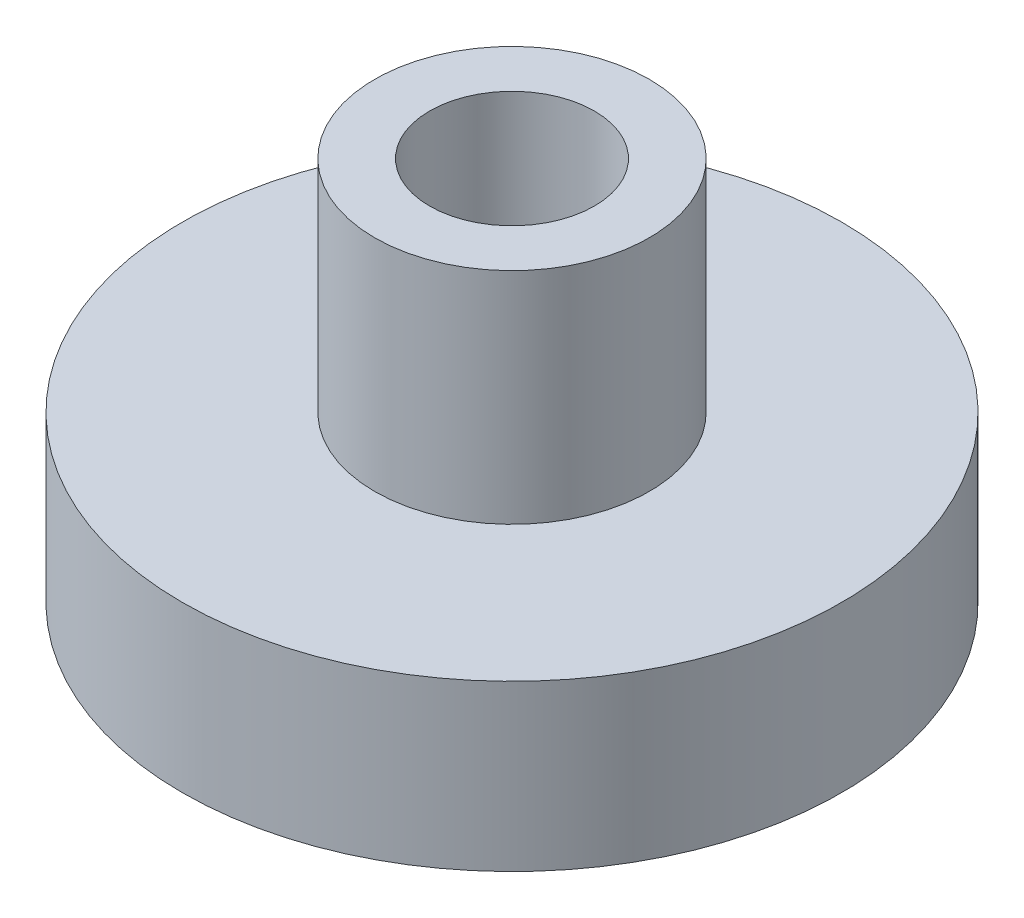
from build123d import *
from build123d.topology import SkipClean

# Parameters (mm, degrees)
SKETCH_1_R      = 2.5
SKETCH_1_R_2    = 1.5
EXTRUDE_1_DEPTH = 4
EXTRUDE_START   = 3
SKETCH_2_R      = 6
SKETCH_2_R_2    = 1.5
EXTRUDE_2_DEPTH = 3


with BuildPart() as part:
    # 草图1 → 凸台-拉伸1 (new body)
    with BuildSketch(Plane(origin=(0, 0, 0), x_dir=(1, 0, 0), z_dir=(0, 1, 0))):
        with Locations(Location((0, 0, 0), (0, 0, 270))):
            Circle(SKETCH_1_R)
        with Locations(Location((0, 0, 0), (0, 0, 270))):
            Circle(SKETCH_1_R_2, mode=Mode.SUBTRACT)
    extrude(amount=EXTRUDE_1_DEPTH)

    # 草图2 → 凸台-拉伸2 (add)
    with SkipClean():  # the faces are left unmerged after this step: merging them gives an invalid solid
        with BuildSketch(Plane.XZ.offset(EXTRUDE_START)):
            with Locations(Location((0, 0, 0), (0, 0, 270))):
                Circle(SKETCH_2_R)
            with Locations(Location((0, 0, 0), (0, 0, 270))):
                Circle(SKETCH_2_R_2, mode=Mode.SUBTRACT)
        extrude(amount=-EXTRUDE_2_DEPTH)


solid = part.part
